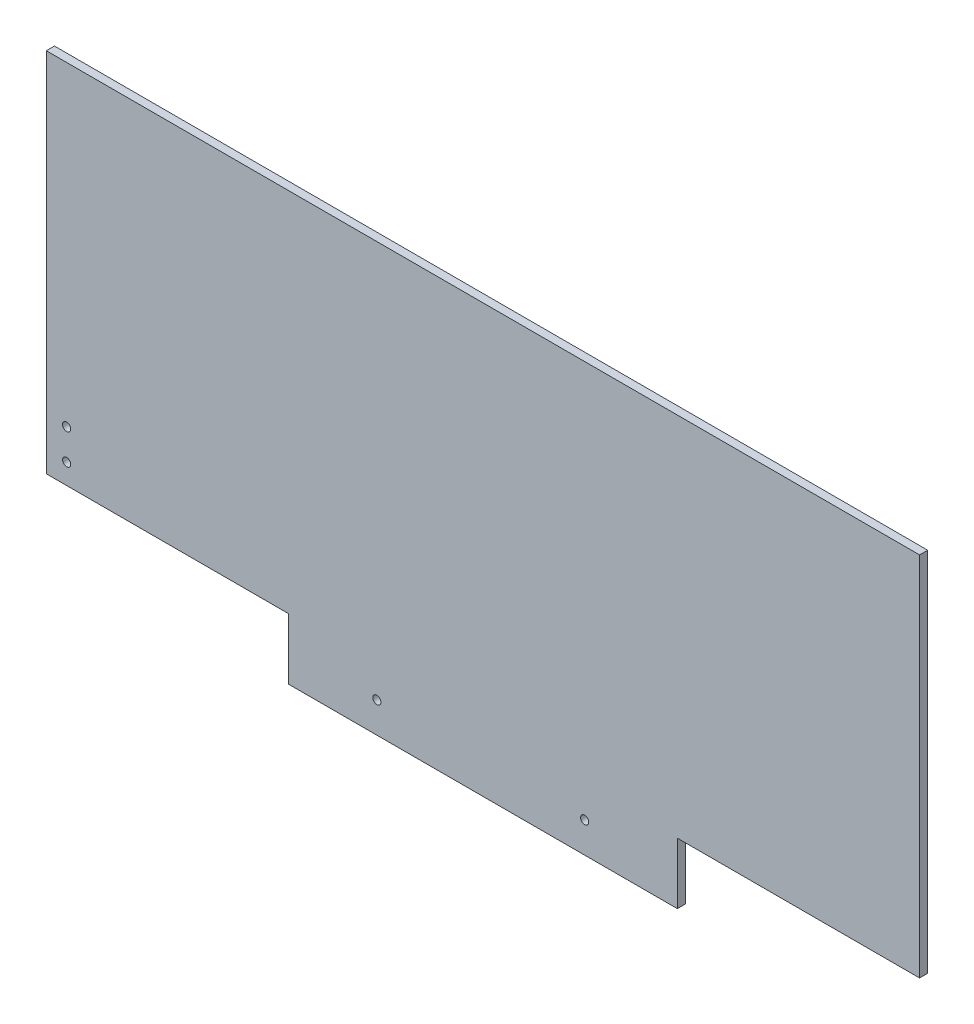
from build123d import *

# Parameters (mm, degrees)
SKETCH1_W           = 429
SKETCH1_H           = 210
BOSS_EXTRUDE1_DEPTH = 4
SKETCH2_W           = 119
SKETCH2_H           = 30
CUT_EXTRUDE1_DEPTH  = 4
SKETCH3_R           = 2
CUT_EXTRUDE2_DEPTH  = 239.854034925
SKETCH4_R           = 2
CUT_EXTRUDE3_DEPTH  = 239.854034925


with BuildPart() as part:
    # Sketch1 → Boss-Extrude1 (new body)
    with BuildSketch(Plane.XY):
        Rectangle(SKETCH1_W, SKETCH1_H)
    extrude(amount=BOSS_EXTRUDE1_DEPTH)

    # Sketch2 → Cut-Extrude1 (cut)
    with BuildSketch(Plane(origin=(0, 0, 0), x_dir=(-1, 0, 0), z_dir=(0, 0, -1))):
        with Locations((-155, -90)):
            Rectangle(SKETCH2_W, SKETCH2_H)
        with Locations((155, -90)):
            Rectangle(SKETCH2_W, SKETCH2_H)
    extrude(amount=-CUT_EXTRUDE1_DEPTH, mode=Mode.SUBTRACT)

    # Sketch3 → Cut-Extrude2 (cut, through all)
    with BuildSketch(Plane(origin=(0, 0, 0), x_dir=(-1, 0, 0), z_dir=(0, 0, -1))):
        with Locations((-49.983602513, -90)):
            Circle(SKETCH3_R)
        with Locations((52.125756906, -90)):
            Circle(SKETCH3_R)
    extrude(amount=-CUT_EXTRUDE2_DEPTH, mode=Mode.SUBTRACT)

    # Sketch4 → Cut-Extrude3 (cut, through all)
    with BuildSketch(Plane(origin=(0, 0, 0), x_dir=(-1, 0, 0), z_dir=(0, 0, -1))):
        with Locations((204.5, -65)):
            Circle(SKETCH4_R)
        with Locations((204.5, -50)):
            Circle(SKETCH4_R)
    extrude(amount=-CUT_EXTRUDE3_DEPTH, mode=Mode.SUBTRACT)


solid = part.part
